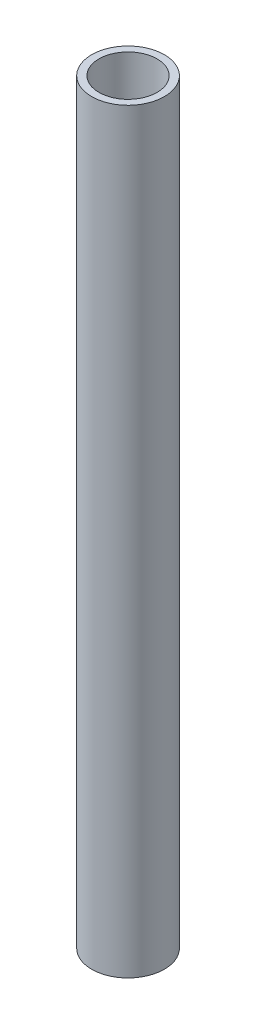
from build123d import *

# Parameters (mm, degrees)
SKETCH1_R           = 1.25
SKETCH1_R_2         = 1
BOSS_EXTRUDE1_DEPTH = 26


with BuildPart() as part:
    # Sketch1 → Boss-Extrude1 (new body)
    with BuildSketch(Plane(origin=(0, 0, 0), x_dir=(1, 0, 0), z_dir=(0, 1, 0))):
        with Locations(Location((0, 0, 0), (0, 0, 90))):
            Circle(SKETCH1_R)
        with Locations(Location((0, 0, 0), (0, 0, 90))):
            Circle(SKETCH1_R_2, mode=Mode.SUBTRACT)
    extrude(amount=BOSS_EXTRUDE1_DEPTH)


solid = part.part
